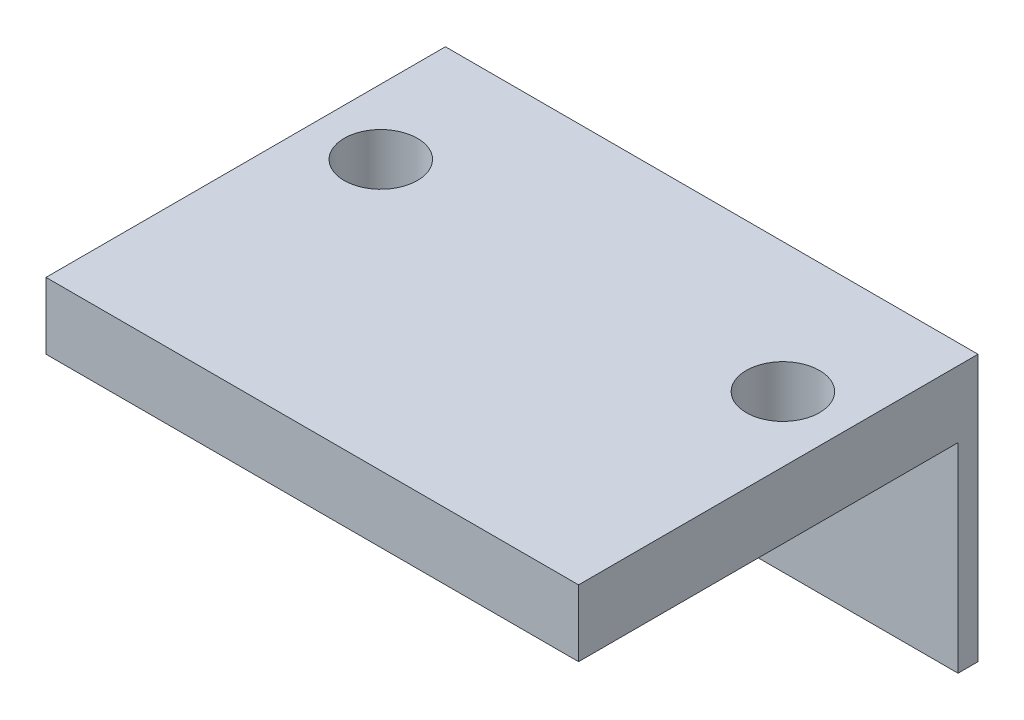
from build123d import *

# Parameters (mm, degrees)
SKETCH1_W           = 80
SKETCH1_H           = 60
BOSS_EXTRUDE1_DEPTH = 10
SKETCH2_R           = 5.5
CUT_EXTRUDE1_DEPTH  = 58.879184514
SKETCH3_W           = 79.999469754
SKETCH3_H           = 3
BOSS_EXTRUDE2_DEPTH = 30


with BuildPart() as part:
    # Sketch1 → Boss-Extrude1 (new body)
    with BuildSketch(Plane(origin=(0, 0, 0), x_dir=(1, 0, 0), z_dir=(0, 1, 0))):
        with Locations((5, -5)):
            Rectangle(SKETCH1_W, SKETCH1_H)
    extrude(amount=BOSS_EXTRUDE1_DEPTH)

    # Sketch2 → Cut-Extrude1 (cut, through all)
    with BuildSketch(Plane(origin=(0, 10, 0), x_dir=(1, 0, 0), z_dir=(0, 1, 0))):
        with Locations(Location((-25.20025306, 5.49130346, 0), (0, 0, 270))):
            Circle(SKETCH2_R)
        with Locations(Location((35.2, 5.49130346, 0), (0, 0, 90))):
            Circle(SKETCH2_R)
    extrude(amount=-CUT_EXTRUDE1_DEPTH, mode=Mode.SUBTRACT)

    # Sketch3 → Boss-Extrude2 (add)
    with BuildSketch(Plane.XZ):
        with Locations((5.000265123, -23.5)):
            Rectangle(SKETCH3_W, SKETCH3_H)
    extrude(amount=BOSS_EXTRUDE2_DEPTH)


solid = part.part
